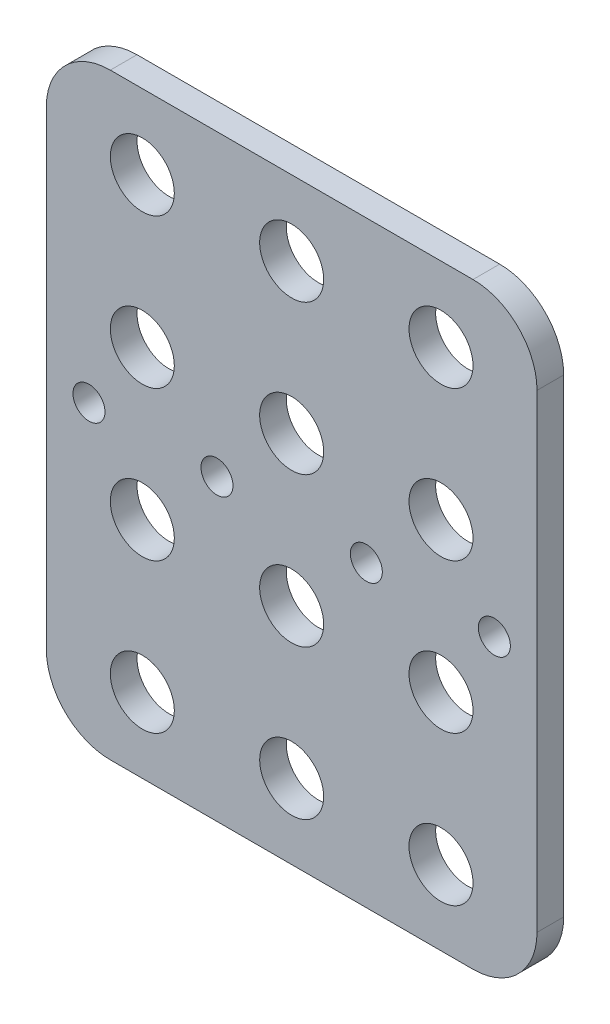
from build123d import *

# Parameters (mm, degrees)
SKETCH_1_W          = 46
SKETCH_1_H          = 56
EXTRUDE_1_DEPTH     = 2.5
FILLET_1_R          = 6
SKETCH_2_R          = 1.5
CUT_EXTRUDE_1_DEPTH = 10
SKETCH_3_R          = 3
CUT_EXTRUDE_2_DEPTH = 10


with BuildPart() as part:
    # 草图1 → 凸台-拉伸1 (new body)
    with BuildSketch(Plane.XY):
        Rectangle(SKETCH_1_W, SKETCH_1_H)
    extrude(amount=EXTRUDE_1_DEPTH)

    # 圆角1
    fillet_1_edges = [part.edges().sort_by_distance(p)[0] for p in [
        (23, -28, 1.25),
        (-23, -28, 1.25),
        (-23, 28, 1.25),
        (23, 28, 1.25),
    ]]
    fillet(fillet_1_edges, radius=FILLET_1_R)

    # 草图2 → 切除-拉伸1 (cut)
    with BuildSketch(Plane.XY.offset(2.5)):
        with Locations((-19, 0)):
            Circle(SKETCH_2_R)
        with Locations((-7, 0)):
            Circle(SKETCH_2_R)
        with Locations((7, 0)):
            Circle(SKETCH_2_R)
        with Locations((19, 0)):
            Circle(SKETCH_2_R)
    extrude(amount=-CUT_EXTRUDE_1_DEPTH, mode=Mode.SUBTRACT)

    # 草图3 → 切除-拉伸2 (cut)
    with BuildSketch(Plane.XY.offset(2.5)):
        with Locations((-14, 7)):
            Circle(SKETCH_3_R)
        with Locations((0, 7)):
            Circle(SKETCH_3_R)
        with Locations((14, 7)):
            Circle(SKETCH_3_R)
        with Locations((-14, -7)):
            Circle(SKETCH_3_R)
        with Locations((0, -7)):
            Circle(SKETCH_3_R)
        with Locations((14, -7)):
            Circle(SKETCH_3_R)
        with Locations((-14, 21)):
            Circle(SKETCH_3_R)
        with Locations((0, 21)):
            Circle(SKETCH_3_R)
        with Locations((14, 21)):
            Circle(SKETCH_3_R)
        with Locations((14, -21)):
            Circle(SKETCH_3_R)
        with Locations((0, -21)):
            Circle(SKETCH_3_R)
        with Locations((-14, -21)):
            Circle(SKETCH_3_R)
    extrude(amount=-CUT_EXTRUDE_2_DEPTH, mode=Mode.SUBTRACT)


solid = part.part
